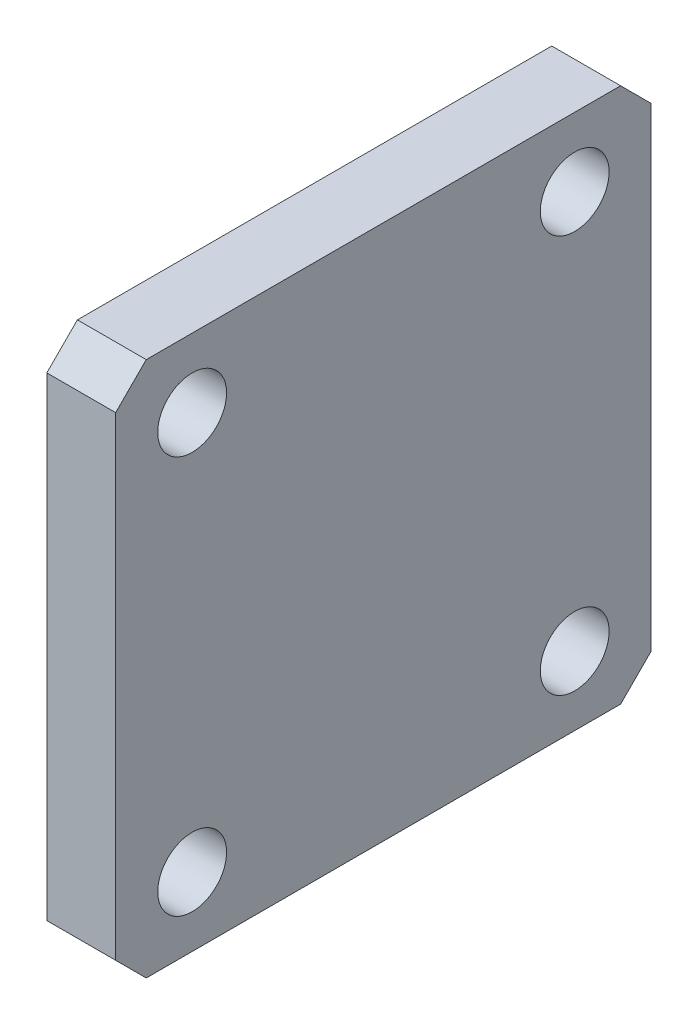
from build123d import *

# Parameters (mm, degrees)
SKETCH_1_W                  = 35
SKETCH_1_H                  = 35
EXTRUDE_1_DEPTH             = 4.5
CHAMFER_1_SIZE              = 2
PATTERN_LINEAR_1_COUNT      = 2
PATTERN_LINEAR_1_PITCH      = 25
PATTERN_LINEAR_1_COUNT_DIR2 = 2
PATTERN_LINEAR_1_PITCH_DIR2 = 26


with BuildPart() as part:
    # Эскиз1 → Бобышка-Вытянуть1 (new body)
    with BuildSketch(Plane(origin=(0, 0, 0), x_dir=(0, 0, -1), z_dir=(1, 0, 0))):
        Rectangle(SKETCH_1_W, SKETCH_1_H)
    extrude(amount=EXTRUDE_1_DEPTH)

    # Фаска1
    chamfer_1_edges = [part.edges().sort_by_distance(p)[0] for p in [
        (2.25, -17.5, -17.5),
        (2.25, 17.5, -17.5),
        (2.25, -17.5, 17.5),
        (2.25, 17.5, 17.5),
    ]]
    chamfer(chamfer_1_edges, length=CHAMFER_1_SIZE)

    # Эскиз3 → Отверстие с зазором M41 (revolve, cut)
    with BuildSketch(Plane(origin=(4.5, 13, -12.5), x_dir=(0, 0, -1), z_dir=(0, 1, 0))):
        Polygon((0, 0), (0, 21.351936393), (2.25, 20), (2.25, 0), align=None)
    hole_wizard_m41 = revolve(axis=Axis((10.85, 13, -12.5), (-1, 0, 0)), mode=Mode.SUBTRACT)

    # Линейный массив1: Hole Wizard M41 2 × 2
    with Locations(*[(0, -j * PATTERN_LINEAR_1_PITCH_DIR2, i * PATTERN_LINEAR_1_PITCH) for i in range(PATTERN_LINEAR_1_COUNT) for j in range(PATTERN_LINEAR_1_COUNT_DIR2) if (i, j) != (0, 0)]):
        add(hole_wizard_m41, mode=Mode.SUBTRACT)


solid = part.part
